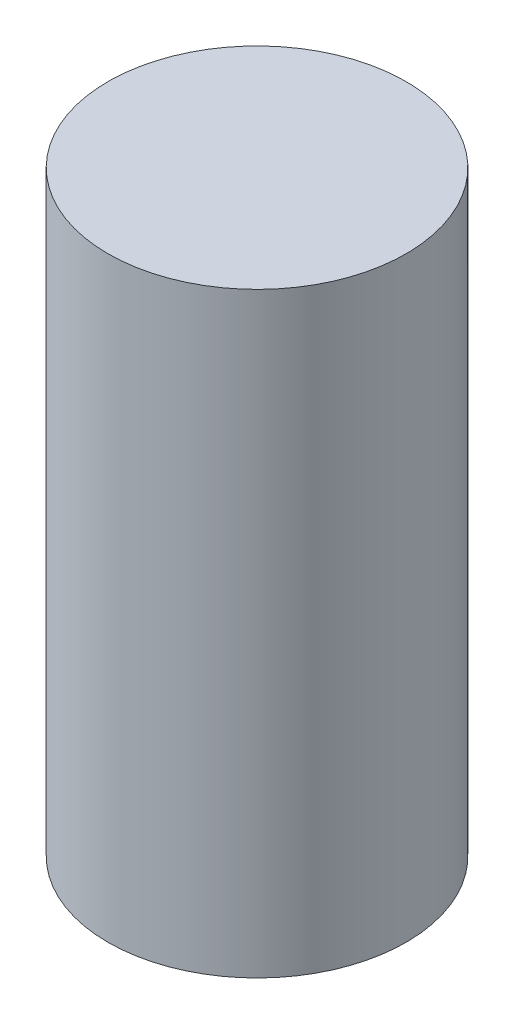
from build123d import *

# Parameters (mm, degrees)
SKETCH1_R           = 12.5
BOSS_EXTRUDE1_DEPTH = 25


with BuildPart() as part:
    # Sketch1 → Boss-Extrude1 (new, symmetric)
    with BuildSketch(Plane(origin=(0, 0, 0), x_dir=(1, 0, 0), z_dir=(0, 1, 0))):
        with Locations(Location((0, 0, 0), (0, 0, 270))):
            Circle(SKETCH1_R)
    extrude(amount=BOSS_EXTRUDE1_DEPTH, both=True)


solid = part.part
